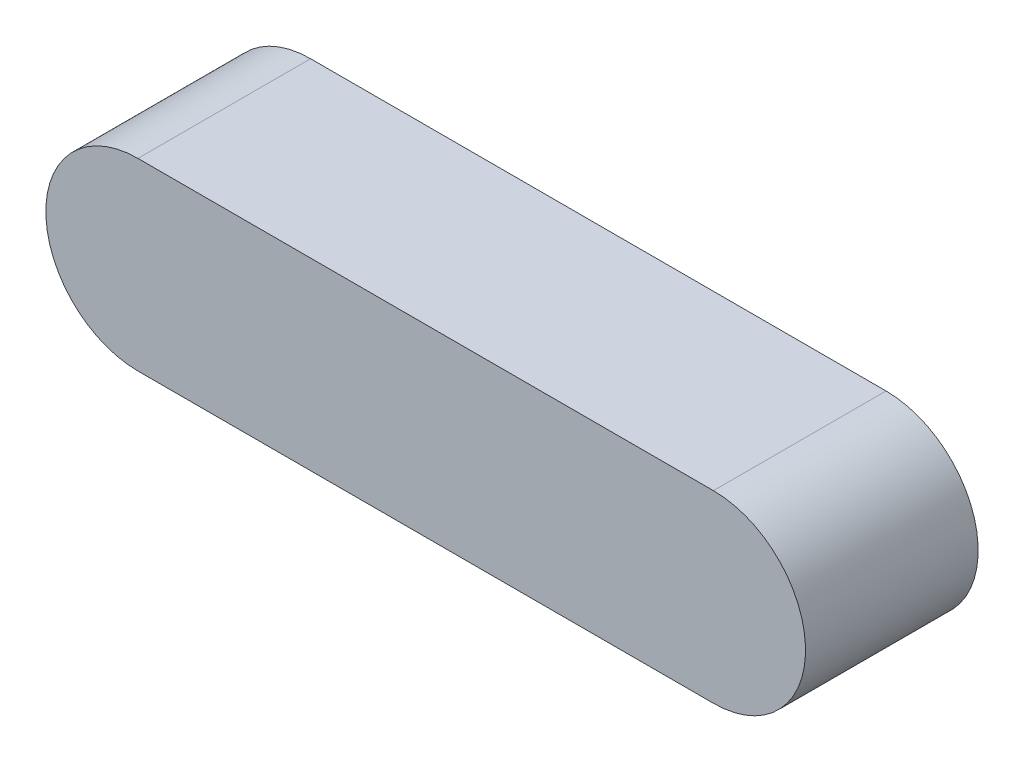
from build123d import *

# Parameters (mm, degrees)
BOSS_EXTRUDE1_DEPTH = 7.5


with BuildPart() as part:
    # Sketch1 → Boss-Extrude1 (new body)
    with BuildSketch(Plane.XY):
        with BuildLine():
            Line((-12.5, 4), (12.5, 4))
            ThreePointArc((12.5, 4), (16.5, 0), (12.5, -4))
            Line((12.5, -4), (-12.5, -4))
            ThreePointArc((-12.5, -4), (-16.5, 0), (-12.5, 4))
        make_face()
    extrude(amount=BOSS_EXTRUDE1_DEPTH)


solid = part.part
